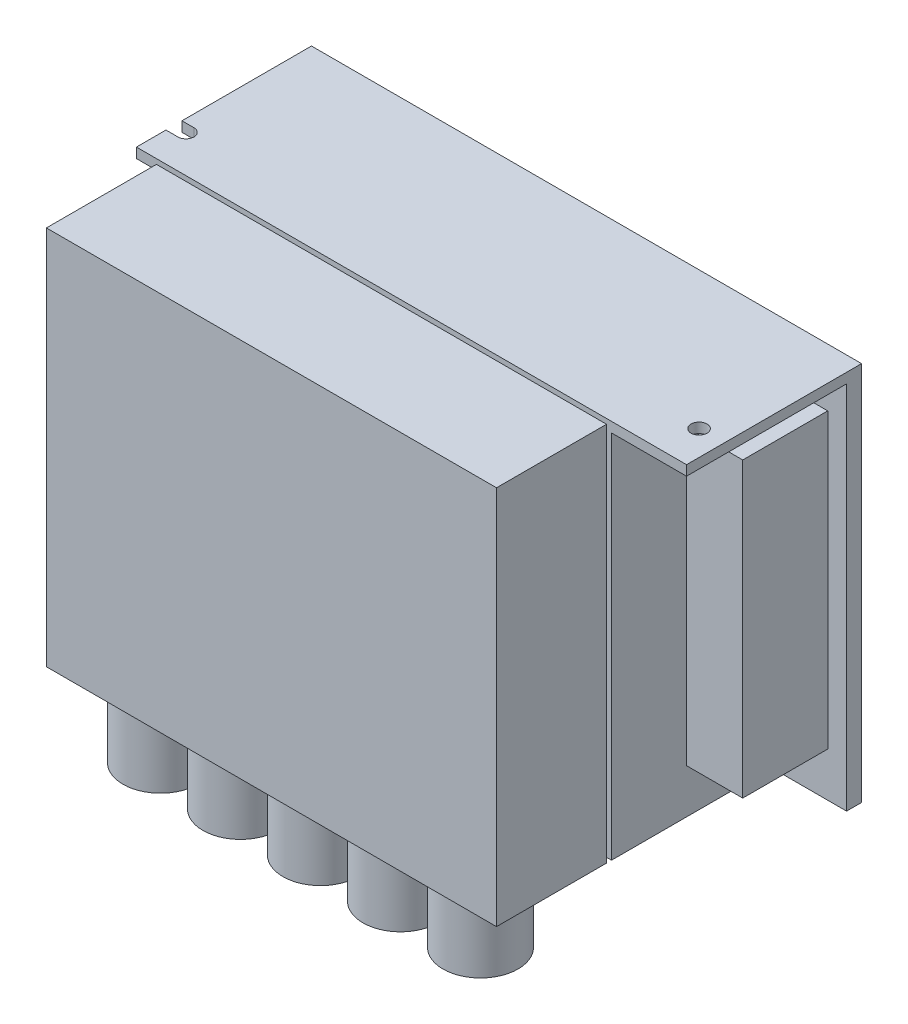
from build123d import *

# Parameters (mm, degrees)
SKETCH1_W           = 110
SKETCH1_H           = 76
BOSS_EXTRUDE1_DEPTH = 35
SKETCH2_W           = 15
SKETCH2_H           = 74
SKETCH2_W_2         = 5
CUT_EXTRUDE1_DEPTH  = 32
SKETCH3_W           = 11.235183257
SKETCH3_H           = 58.560748925
BOSS_EXTRUDE2_DEPTH = 17
SKETCH4_W           = 85.227436201
SKETCH4_H           = 71.879332631
BOSS_EXTRUDE3_DEPTH = 1
SKETCH5_W           = 90
SKETCH5_H           = 76
BOSS_EXTRUDE4_DEPTH = 22
SKETCH6_R           = 7.5
BOSS_EXTRUDE5_DEPTH = 15
SKETCH7_R           = 1.6
CUT_EXTRUDE2_DEPTH  = 5


with BuildPart() as part:
    # Sketch1 → Boss-Extrude1 (new body)
    with BuildSketch(Plane.XY):
        Rectangle(SKETCH1_W, SKETCH1_H)
    extrude(amount=BOSS_EXTRUDE1_DEPTH)

    # Sketch2 → Cut-Extrude1 (cut)
    with BuildSketch(Plane.XY.offset(35)):
        with Locations((47.5, -1)):
            Rectangle(SKETCH2_W, SKETCH2_H)
        with Locations((-52.5, -1)):
            Rectangle(SKETCH2_W_2, SKETCH2_H)
    extrude(amount=-CUT_EXTRUDE1_DEPTH, mode=Mode.SUBTRACT)

    # Sketch3 → Boss-Extrude2 (add)
    with BuildSketch(Plane.XY.offset(3)):
        with Locations((45.617591629, 0.154641352)):
            Rectangle(SKETCH3_W, SKETCH3_H)
    extrude(amount=BOSS_EXTRUDE2_DEPTH)

    # Sketch4 → Boss-Extrude3 (add)
    with BuildSketch(Plane.XY.offset(35)):
        with Locations((-4.69027722, 0.263838975)):
            Rectangle(SKETCH4_W, SKETCH4_H)
    extrude(amount=BOSS_EXTRUDE3_DEPTH)

    # Sketch5 → Boss-Extrude4 (add)
    with BuildSketch(Plane.XY.offset(36)):
        with Locations((-5, 0)):
            Rectangle(SKETCH5_W, SKETCH5_H)
    extrude(amount=BOSS_EXTRUDE4_DEPTH)

    # Sketch6 → Boss-Extrude5 (add)
    with BuildSketch(Plane.XZ.offset(38)):
        with Locations((-5, 48.2)):
            Circle(SKETCH6_R)
        with Locations((11, 48.2)):
            Circle(SKETCH6_R)
        with Locations((27, 48.2)):
            Circle(SKETCH6_R)
        with Locations((-21, 48.2)):
            Circle(SKETCH6_R)
        with Locations((-37, 48.2)):
            Circle(SKETCH6_R)
    extrude(amount=BOSS_EXTRUDE5_DEPTH)

    # Sketch7 → Cut-Extrude2 (cut)
    with BuildSketch(Plane.XZ.offset(-36)):
        with Locations((50, 27.5)):
            Circle(SKETCH7_R)
        with BuildLine():
            Line((-55, 29.1), (-52.6, 29.1))
            ThreePointArc((-52.6, 29.1), (-51, 27.5), (-52.6, 25.9))
            Line((-52.6, 25.9), (-55, 25.9))
            Line((-55, 25.9), (-55, 29.1))
        make_face()
    extrude(amount=-CUT_EXTRUDE2_DEPTH, mode=Mode.SUBTRACT)


solid = part.part
